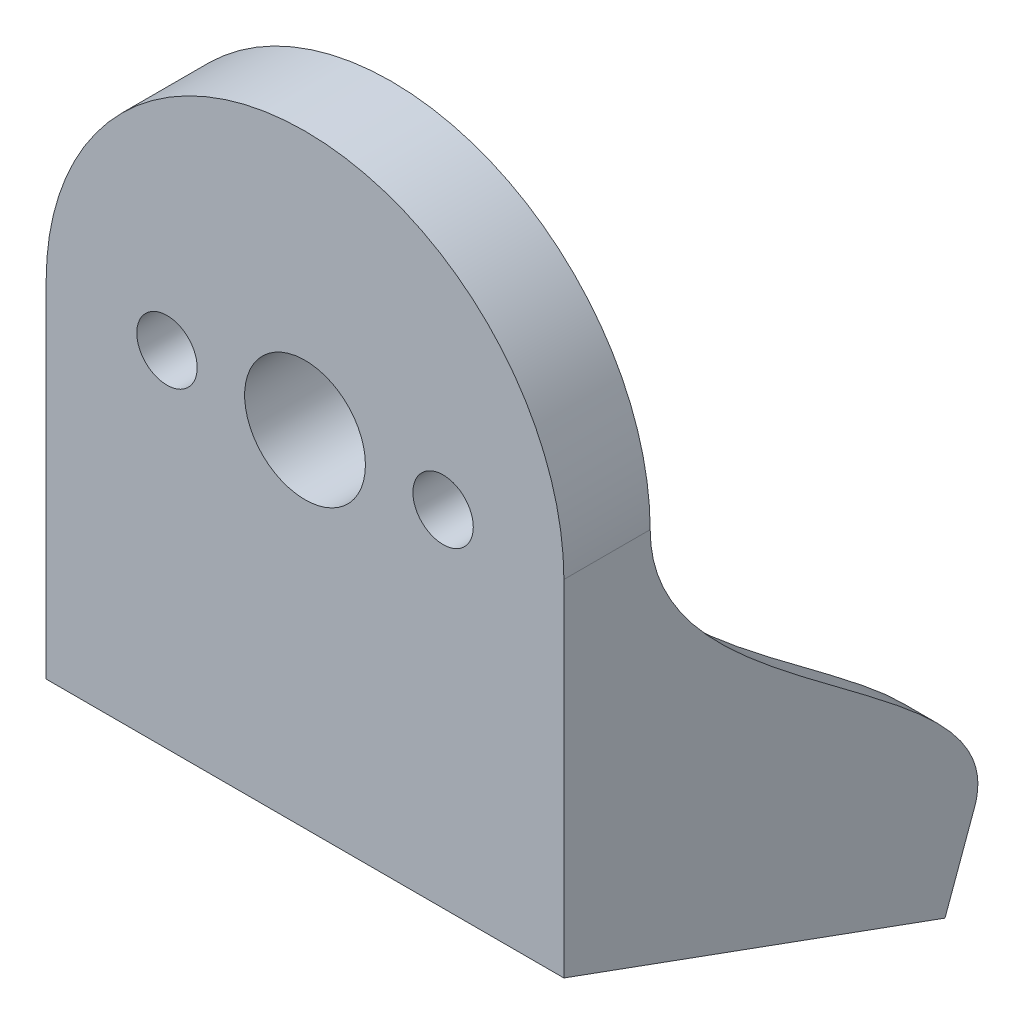
from build123d import *

# Parameters (mm, degrees)
ESQUISSE1_R             = 1.75
ESQUISSE1_R_2           = 3.5
BOSS_EXTRU_1_DEPTH      = 5
ENL_V_MAT_EXTRU_2_REACH = 41.592
BOSS_EXTRU_2_DEPTH      = 30
ESQUISSE5_W             = 30
ESQUISSE5_H             = 5
BOSS_EXTRU_3_DEPTH      = 20
BOSS_EXTRU_4_DEPTH      = 2
BOSS_EXTRU_5_DEPTH      = 2
ENL_V_MAT_EXTRU_3_REACH = 42.516
ESQUISSE12_R            = 1.75
BOSS_EXTRU_6_DEPTH      = 4
BOSS_EXTRU_6_DEPTH_BACK = 4


with BuildPart() as part:
    # Esquisse1 → Boss.-Extru.1 (new body)
    with BuildSketch(Plane.XY):
        with BuildLine():
            Line((-15.959557324, 10.348837209), (-15.959557324, -9.651162791))
            Line((-15.959557324, -9.651162791), (14.040442676, -9.651162791))
            Line((14.040442676, -9.651162791), (14.040442676, 10.348837209))
            ThreePointArc((14.040442676, 10.348837209), (-0.959557324, 25.348837209), (-15.959557324, 10.348837209))
        make_face()
        with Locations((-8.959557324, 10.348837209)):
            Circle(ESQUISSE1_R, mode=Mode.SUBTRACT)
        with Locations((7.040442676, 10.348837209)):
            Circle(ESQUISSE1_R, mode=Mode.SUBTRACT)
        with Locations((-0.959557324, 10.348837209)):
            Circle(ESQUISSE1_R_2, mode=Mode.SUBTRACT)
    extrude(amount=BOSS_EXTRU_1_DEPTH)

    # Esquisse2 → Enlèv. mat.-Extru.2 (cut, up to next)
    with BuildSketch(Plane.ZY.offset(15.959557324), mode=Mode.PRIVATE) as enl_v_mat_extru_2_sk1:
        Polygon((0, -9.651162791), (0, -6.1501251), (1.274273509, -9.651162791), align=None)
    enl_v_mat_extru_2_tool1 = extrude(enl_v_mat_extru_2_sk1.sketch, amount=-ENL_V_MAT_EXTRU_2_REACH, mode=Mode.PRIVATE) & part.part
    add(enl_v_mat_extru_2_tool1.solids().sort_by_distance((-15.959557, -8.48415, 0.424758))[0], mode=Mode.SUBTRACT)

    # Esquisse4 → Boss.-Extru.2 (add)
    with BuildSketch(Plane.ZY.offset(15.959557324)):
        Polygon((5, -9.651162791), (1.710100717, -10.848588204), (1.274273509, -9.651162791), align=None)
    extrude(amount=-BOSS_EXTRU_2_DEPTH)

    # Esquisse5 → Boss.-Extru.3 (add)
    with BuildSketch(Plane(origin=(0, -0.719427971, -1.976612106), x_dir=(-1, 0, 0), z_dir=(0, -0.34202014332566333, -0.9396926207859103))):
        with Locations((0.959557324, -8.279227173)):
            Rectangle(ESQUISSE5_W, ESQUISSE5_H)
    extrude(amount=BOSS_EXTRU_3_DEPTH)

    # Esquisse6 → Boss.-Extru.4 (add)
    with BuildSketch(Plane.ZY.offset(15.959557324)):
        with BuildLine():
            Line((0, 10.348837209), (0, -6.1501251))
            Line((0, -6.1501251), (-18.793852416, -12.990527966))
            add(Edge.make_bspline(
                [(0, 10.348837209), (0, 0.360316824), (-21.221447274, -6.32076591), (-18.793852416, -12.990527966)],
                knots=[0, 0, 0, 0, 1, 1, 1, 1], degree=3))
        make_face()
    extrude(amount=-BOSS_EXTRU_4_DEPTH)

    # Esquisse11 → Boss.-Extru.5 (add)
    with BuildSketch(Plane.ZY.offset(-14.040442676)):
        with BuildLine():
            Line((0, 10.348837209), (0, -6.1501251))
            Line((0, -6.1501251), (-18.793852416, -12.990527966))
            add(Edge.make_bspline(
                [(0, 10.348837209), (0, 0.360316824), (-21.221447274, -6.32076591), (-18.793852416, -12.990527966)],
                knots=[0, 0, 0, 0, 1, 1, 1, 1], degree=3))
        make_face()
    extrude(amount=BOSS_EXTRU_5_DEPTH)

    # Esquisse12 → Enlèv. mat.-Extru.3 (cut, up to next)
    with BuildSketch(Plane(origin=(0, -5.430697128, 1.976612106), x_dir=(1, 0, 0), z_dir=(0, 0.9396926207859103, -0.34202014332566333)), mode=Mode.PRIVATE) as enl_v_mat_extru_3_sk1:
        with Locations(Location((-9.959557324, 18.103466668, 0), (0, 0, 270))):
            Circle(ESQUISSE12_R)
    enl_v_mat_extru_3_tool1 = extrude(enl_v_mat_extru_3_sk1.sketch, amount=-ENL_V_MAT_EXTRU_3_REACH, mode=Mode.PRIVATE) & part.part
    # Esquisse12 → Enlèv. mat.-Extru.3 (cut, up to next)
    with BuildSketch(Plane(origin=(0, -5.430697128, 1.976612106), x_dir=(1, 0, 0), z_dir=(0, 0.9396926207859103, -0.34202014332566333)), mode=Mode.PRIVATE) as enl_v_mat_extru_3_sk2:
        with Locations(Location((8.040442676, 18.103466668, 0), (0, 0, 270))):
            Circle(ESQUISSE12_R)
    enl_v_mat_extru_3_tool2 = extrude(enl_v_mat_extru_3_sk2.sketch, amount=-ENL_V_MAT_EXTRU_3_REACH, mode=Mode.PRIVATE) & part.part
    # Esquisse12 → Enlèv. mat.-Extru.3 (cut, up to next)
    with BuildSketch(Plane(origin=(0, -5.430697128, 1.976612106), x_dir=(1, 0, 0), z_dir=(0, 0.9396926207859103, -0.34202014332566333)), mode=Mode.PRIVATE) as enl_v_mat_extru_3_sk3:
        with Locations(Location((8.040442676, 6.103466668, 0), (0, 0, 270))):
            Circle(ESQUISSE12_R)
    enl_v_mat_extru_3_tool3 = extrude(enl_v_mat_extru_3_sk3.sketch, amount=-ENL_V_MAT_EXTRU_3_REACH, mode=Mode.PRIVATE) & part.part
    # Esquisse12 → Enlèv. mat.-Extru.3 (cut, up to next)
    with BuildSketch(Plane(origin=(0, -5.430697128, 1.976612106), x_dir=(1, 0, 0), z_dir=(0, 0.9396926207859103, -0.34202014332566333)), mode=Mode.PRIVATE) as enl_v_mat_extru_3_sk4:
        with Locations(Location((-9.959557324, 6.103466668, 0), (0, 0, 270))):
            Circle(ESQUISSE12_R)
    enl_v_mat_extru_3_tool4 = extrude(enl_v_mat_extru_3_sk4.sketch, amount=-ENL_V_MAT_EXTRU_3_REACH, mode=Mode.PRIVATE) & part.part
    add(enl_v_mat_extru_3_tool1.solids().sort_by_distance((-9.959557, -11.622447, -15.035082))[0], mode=Mode.SUBTRACT)
    add(enl_v_mat_extru_3_tool2.solids().sort_by_distance((8.040443, -11.622447, -15.035082))[0], mode=Mode.SUBTRACT)
    add(enl_v_mat_extru_3_tool3.solids().sort_by_distance((8.040443, -7.518206, -3.75877))[0], mode=Mode.SUBTRACT)
    add(enl_v_mat_extru_3_tool4.solids().sort_by_distance((-9.959557, -7.518206, -3.75877))[0], mode=Mode.SUBTRACT)

    # Esquisse16 → Boss.-Extru.6 (add, two sides: drawn at the far end of the back side and taken through both)
    with BuildSketch(Plane(origin=(-0.959557324, 0, 0), x_dir=(0, 0, -1), z_dir=(1, 0, 0)).offset(-BOSS_EXTRU_6_DEPTH_BACK)):
        Polygon((18.793852416, -12.990527966), (0, -6.1501251), (0, -2.534631071), align=None)
    extrude(amount=BOSS_EXTRU_6_DEPTH + BOSS_EXTRU_6_DEPTH_BACK)


solid = part.part
